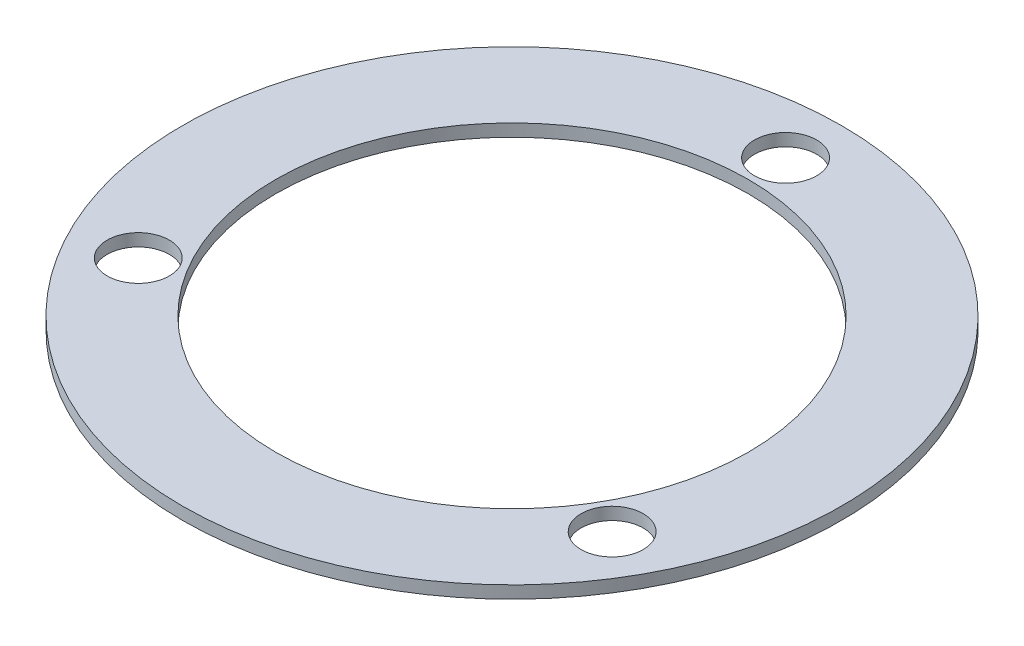
from build123d import *

# Parameters (mm, degrees)
SKETCH1_R           = 13.25
SKETCH1_R_2         = 9.5
SKETCH1_R_3         = 1.25
BOSS_EXTRUDE1_DEPTH = 0.5


with BuildPart() as part:
    # Sketch1 → Boss-Extrude1 (new body)
    with BuildSketch(Plane(origin=(0, 0, 0), x_dir=(1, 0, 0), z_dir=(0, 1, 0))):
        with Locations(Location((0, 0, 0), (0, 0, 270))):
            Circle(SKETCH1_R)
        with Locations(Location((0, 0, 0), (0, 0, 270))):
            Circle(SKETCH1_R_2, mode=Mode.SUBTRACT)
        with Locations(Location((0, 11, 0), (0, 0, 270))):
            Circle(SKETCH1_R_3, mode=Mode.SUBTRACT)
        with Locations(Location((9.526279442, -5.5, 0), (0, 0, 270))):
            Circle(SKETCH1_R_3, mode=Mode.SUBTRACT)
        with Locations(Location((-9.526279442, -5.5, 0), (0, 0, 270))):
            Circle(SKETCH1_R_3, mode=Mode.SUBTRACT)
    extrude(amount=BOSS_EXTRUDE1_DEPTH)


solid = part.part
